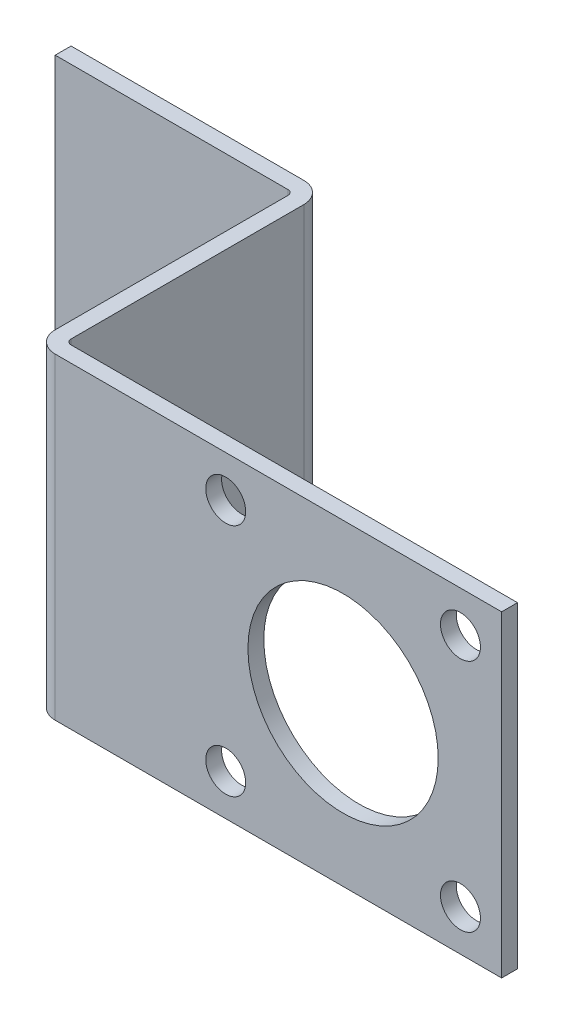
from build123d import *

# Parameters (mm, degrees)
BOSS_EXTRUDE1_DEPTH     = 31.75
CUT_EXTRUDE1_DEPTH      = 127.564991094
CUT_EXTRUDE1_DEPTH_BACK = 127.564991094
SKETCH1_R               = 19.05
SKETCH1_R_2             = 4


with BuildPart() as part:
    # Sketch2 → Boss-Extrude1 (new, symmetric)
    with BuildSketch(Plane(origin=(0, 0, 0), x_dir=(1, 0, 0), z_dir=(0, 1, 0))):
        with BuildLine():
            Line((31.75, 0), (-57.657873, 0))
            ThreePointArc((-57.657873, 0), (-60.62135752, 1.22751548), (-61.848873, 4.191))
            Line((-61.848873, 4.191), (-61.848873, 50.81905))
            ThreePointArc((-61.848873, 50.81905), (-62.14645251, 51.53747049), (-62.864873, 51.83505))
            Line((-62.864873, 51.83505), (-109.473873, 51.83505))
            Line((-109.473873, 51.83505), (-109.473873, 55.01005))
            Line((-109.473873, 55.01005), (-62.864873, 55.01005))
            ThreePointArc((-62.864873, 55.01005), (-59.90138848, 53.78253452), (-58.673873, 50.81905))
            Line((-58.673873, 50.81905), (-58.673873, 4.191))
            ThreePointArc((-58.673873, 4.191), (-58.37629349, 3.47257951), (-57.657873, 3.175))
            Line((-57.657873, 3.175), (31.75, 3.175))
            Line((31.75, 3.175), (31.75, 0))
        make_face()
    extrude(amount=BOSS_EXTRUDE1_DEPTH, both=True)

    # Sketch1 → Cut-Extrude1 (cut, two sides: drawn at the far end of the back side and taken through both)
    with BuildSketch(Plane.XY.offset(-CUT_EXTRUDE1_DEPTH_BACK)):
        Circle(SKETCH1_R)
        with Locations((23.5, 23.5)):
            Circle(SKETCH1_R_2)
        with Locations((23.5, -23.5)):
            Circle(SKETCH1_R_2)
        with Locations((-23.5, -23.5)):
            Circle(SKETCH1_R_2)
        with Locations((-23.5, 23.5)):
            Circle(SKETCH1_R_2)
    extrude(amount=CUT_EXTRUDE1_DEPTH + CUT_EXTRUDE1_DEPTH_BACK, mode=Mode.SUBTRACT)


solid = part.part
